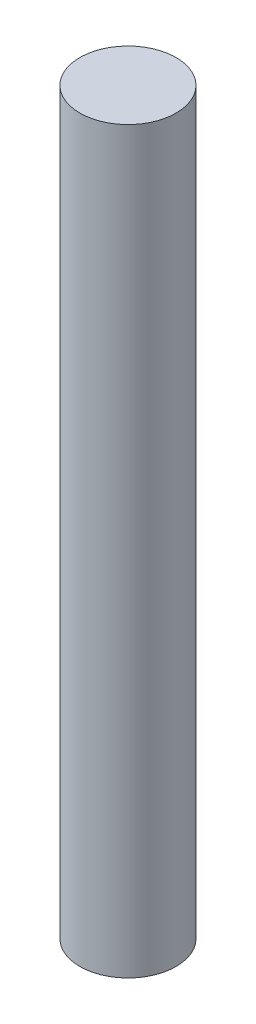
from build123d import *

# Parameters (mm, degrees)
SKETCH1_R           = 1.55
BOSS_EXTRUDE1_DEPTH = 23.8


with BuildPart() as part:
    # Sketch1 → Boss-Extrude1 (new body)
    with BuildSketch(Plane(origin=(0, 0, 0), x_dir=(1, 0, 0), z_dir=(0, 1, 0))):
        with Locations(Location((0, 0, 0), (0, 0, 270))):
            Circle(SKETCH1_R)
    extrude(amount=BOSS_EXTRUDE1_DEPTH)


solid = part.part
